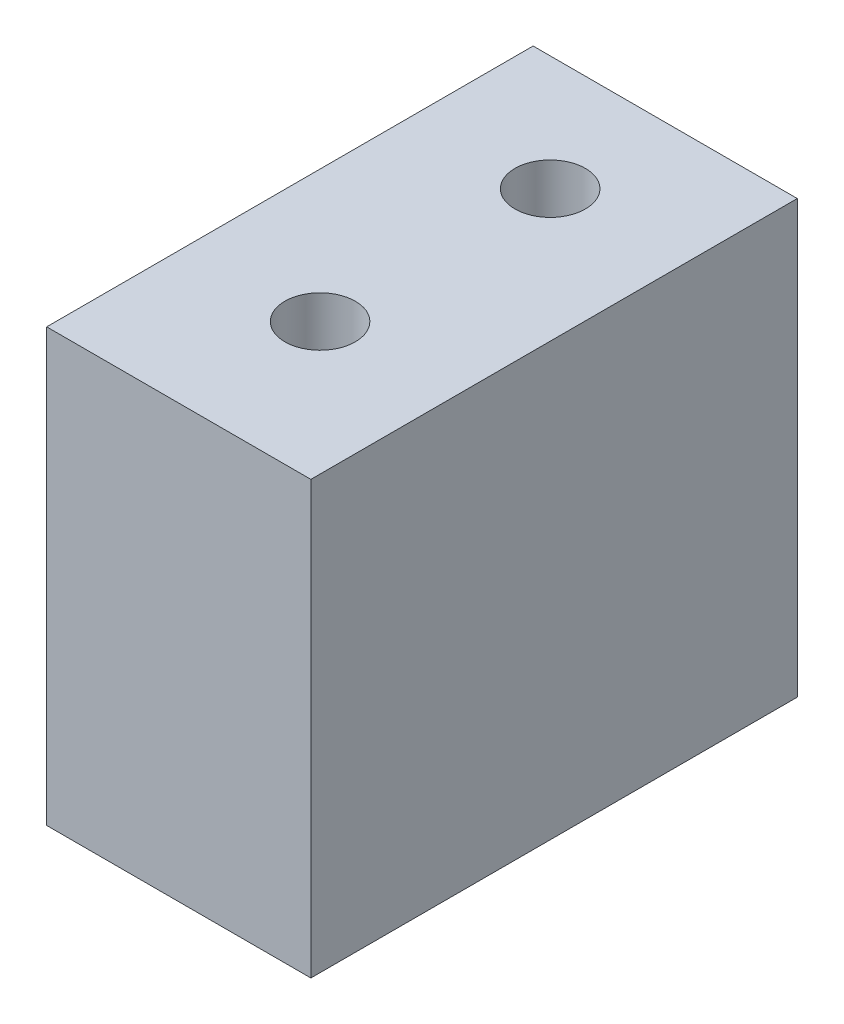
from build123d import *

# Parameters (mm, degrees)
ESQUISSE1_W             = 15
ESQUISSE1_H             = 24.52
BOSS_EXTRU_1_DEPTH      = 27.62
ENL_V_MAT_EXTRU_1_DEPTH = 3
ENL_V_MAT_EXTRU_2_DEPTH = 3


with BuildPart() as part:
    # Esquisse1 → Boss.-Extru.1 (new body)
    with BuildSketch(Plane.XY):
        with Locations((-7.5, 12.26)):
            Rectangle(ESQUISSE1_W, ESQUISSE1_H)
    extrude(amount=-BOSS_EXTRU_1_DEPTH)

    # Esquisse2 → Enlèv. mat.-Extru.1 (cut)
    with BuildSketch(Plane(origin=(0, 24.52, 0), x_dir=(1, 0, 0), z_dir=(0, 1, 0))):
        with BuildLine():
            ThreePointArc((-7.5, 23.0875), (-9.5, 21.0875), (-7.5, 19.0875))
            Line((-7.5, 19.0875), (-7.5, 23.0875))
        make_face()
        with BuildLine():
            Line((-7.5, 23.0875), (-7.5, 19.0875))
            ThreePointArc((-7.5, 19.0875), (-6.085786438, 19.673286438), (-5.5, 21.0875))
            ThreePointArc((-5.5, 21.0875), (-6.085786438, 22.501713562), (-7.5, 23.0875))
        make_face()
        with BuildLine():
            ThreePointArc((-5.5, 8.0225), (-6.085786438, 9.436713562), (-7.5, 10.0225))
            Line((-7.5, 10.0225), (-7.5, 6.0225))
            ThreePointArc((-7.5, 6.0225), (-6.085786438, 6.608286438), (-5.5, 8.0225))
        make_face()
        with BuildLine():
            Line((-7.5, 6.0225), (-7.5, 10.0225))
            ThreePointArc((-7.5, 10.0225), (-9.5, 8.0225), (-7.5, 6.0225))
        make_face()
    extrude(amount=-ENL_V_MAT_EXTRU_1_DEPTH, mode=Mode.SUBTRACT)

    # Esquisse3 → Enlèv. mat.-Extru.2 (cut)
    with BuildSketch(Plane.XZ):
        with BuildLine():
            ThreePointArc((-7.5, -4.905), (-9.5, -6.905), (-7.5, -8.905))
            Line((-7.5, -8.905), (-7.5, -4.905))
        make_face()
        with BuildLine():
            Line((-7.5, -4.905), (-7.5, -8.905))
            ThreePointArc((-7.5, -8.905), (-6.085786438, -8.319213562), (-5.5, -6.905))
            ThreePointArc((-5.5, -6.905), (-6.085786438, -5.490786438), (-7.5, -4.905))
        make_face()
        with BuildLine():
            ThreePointArc((-5.5, -20.715), (-6.085786438, -19.300786438), (-7.5, -18.715))
            Line((-7.5, -18.715), (-7.5, -22.715))
            ThreePointArc((-7.5, -22.715), (-6.085786438, -22.129213562), (-5.5, -20.715))
        make_face()
        with BuildLine():
            Line((-7.5, -22.715), (-7.5, -18.715))
            ThreePointArc((-7.5, -18.715), (-9.5, -20.715), (-7.5, -22.715))
        make_face()
    extrude(amount=-ENL_V_MAT_EXTRU_2_DEPTH, mode=Mode.SUBTRACT)


solid = part.part
